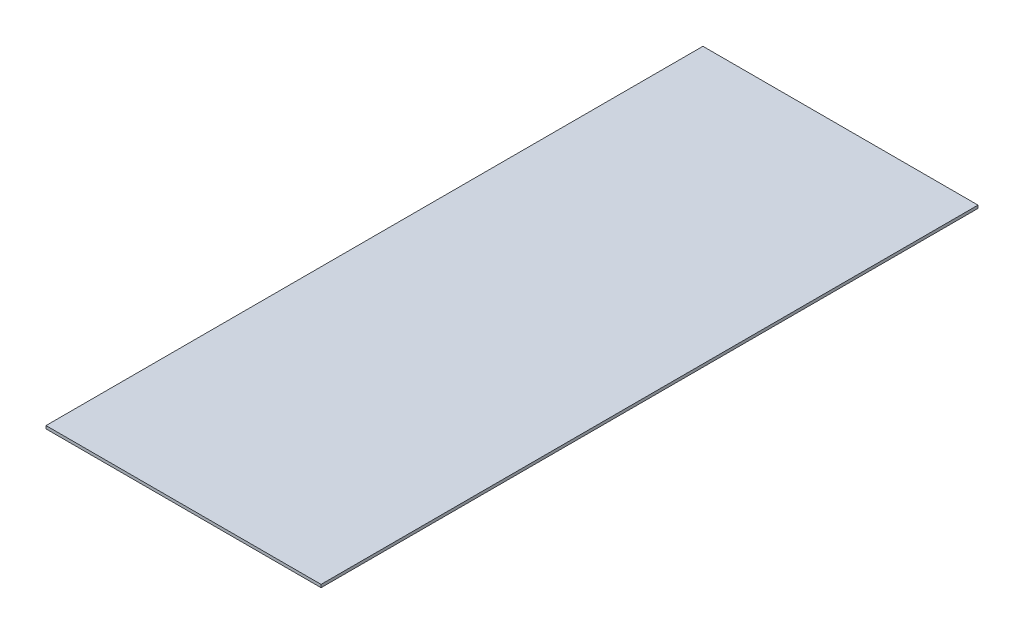
from build123d import *

# Parameters (mm, degrees)
SKETCH1_W           = 17
SKETCH1_H           = 40.6
BOSS_EXTRUDE1_DEPTH = 0.18


with BuildPart() as part:
    # Sketch1 → Boss-Extrude1 (new body)
    with BuildSketch(Plane(origin=(0, 0, 0), x_dir=(1, 0, 0), z_dir=(0, 1, 0))):
        with Locations((8.5, 20.3)):
            Rectangle(SKETCH1_W, SKETCH1_H)
    extrude(amount=BOSS_EXTRUDE1_DEPTH)


solid = part.part
